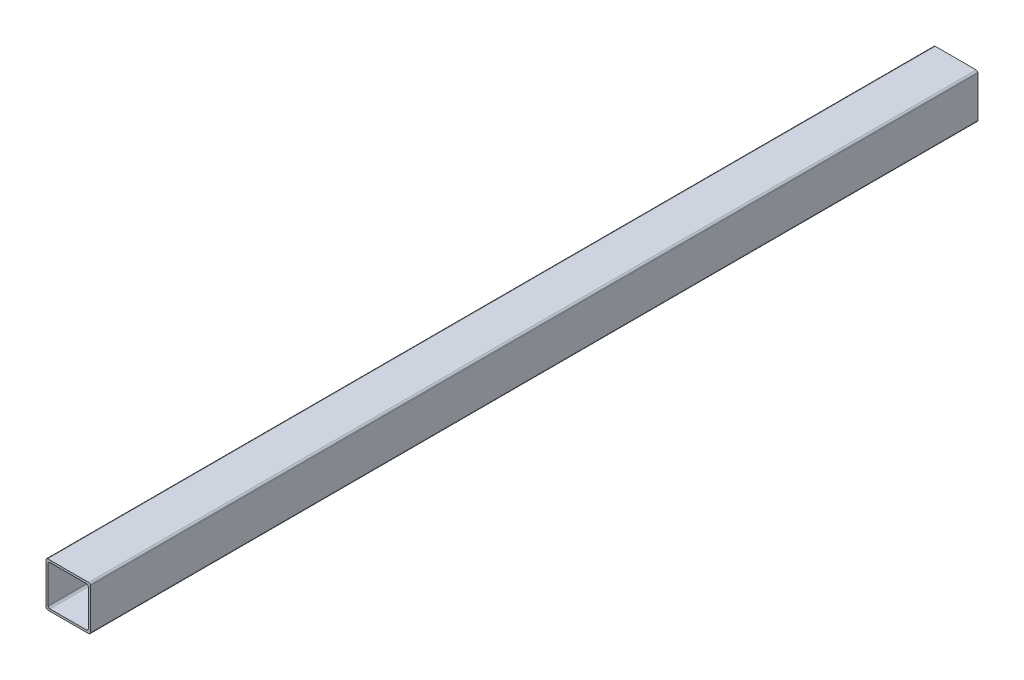
from build123d import *

# Parameters (mm, degrees)
EXTRUDE_1_DEPTH = 500


with BuildPart() as part:
    # 草图1 → 拉伸1 (new body)
    with BuildSketch(Plane.XY):
        with BuildLine():
            Line((-11.537, 12.5), (11.537, 12.5))
            ThreePointArc((11.537, 12.5), (12.21794383, 12.21794383), (12.5, 11.537))
            Line((12.5, 11.537), (12.5, -11.537))
            ThreePointArc((12.5, -11.537), (12.21794383, -12.21794383), (11.537, -12.5))
            Line((11.537, -12.5), (-11.537, -12.5))
            ThreePointArc((-11.537, -12.5), (-12.21794383, -12.21794383), (-12.5, -11.537))
            Line((-12.5, -11.537), (-12.5, 11.537))
            ThreePointArc((-12.5, 11.537), (-12.21794383, 12.21794383), (-11.537, 12.5))
        make_face()
        with BuildLine():
            Line((-10.337, 11.3), (10.337, 11.3))
            ThreePointArc((10.337, 11.3), (11.01794383, 11.01794383), (11.3, 10.337))
            Line((11.3, 10.337), (11.3, -10.337))
            ThreePointArc((11.3, -10.337), (11.01794383, -11.01794383), (10.337, -11.3))
            Line((10.337, -11.3), (-10.337, -11.3))
            ThreePointArc((-10.337, -11.3), (-11.01794383, -11.01794383), (-11.3, -10.337))
            Line((-11.3, -10.337), (-11.3, 10.337))
            ThreePointArc((-11.3, 10.337), (-11.01794383, 11.01794383), (-10.337, 11.3))
        make_face(mode=Mode.SUBTRACT)
    extrude(amount=EXTRUDE_1_DEPTH)


solid = part.part
